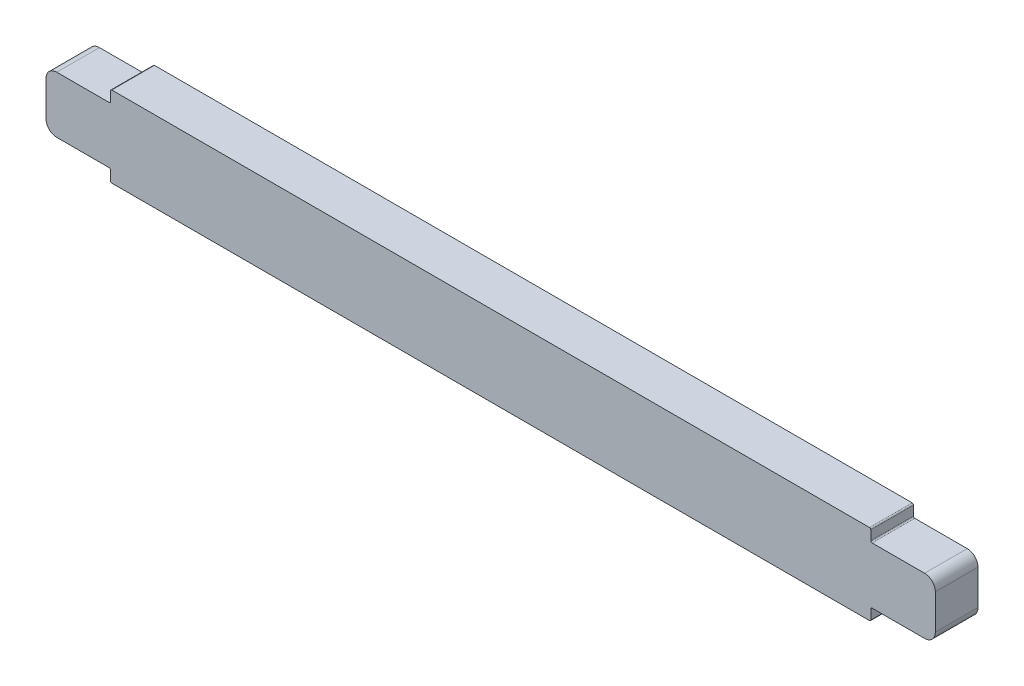
from build123d import *

# Parameters (mm, degrees)
SKETCH1_W           = 66.16
SKETCH1_H           = 6
BOSS_EXTRUDE1_DEPTH = 3.175
SKETCH3_W           = 4.8
SKETCH3_H           = 0.9
CUT_EXTRUDE1_DEPTH  = 34.367154883
FILLET1_R           = 0.8
FILLET2_R           = 0.1


with BuildPart() as part:
    # Sketch1 → Boss-Extrude1 (new body)
    with BuildSketch(Plane.XY):
        Rectangle(SKETCH1_W, SKETCH1_H)
    extrude(amount=BOSS_EXTRUDE1_DEPTH)

    # Sketch3 → Cut-Extrude1 (cut, through all)
    with BuildSketch(Plane.XY.offset(3.175)):
        with Locations((-30.68, 2.55)):
            Rectangle(SKETCH3_W, SKETCH3_H)
        with Locations((-30.68, -2.55)):
            Rectangle(SKETCH3_W, SKETCH3_H)
    cut_extrude1 = extrude(amount=-CUT_EXTRUDE1_DEPTH, mode=Mode.SUBTRACT)

    # Mirror1: Cut-Extrude1 across plane
    add(cut_extrude1.mirror(Plane(origin=(0, 0, 0), x_dir=(0, 0, 1), z_dir=(1, 0, 0))), mode=Mode.SUBTRACT)

    # Fillet1
    fillet1_edges = [part.edges().sort_by_distance(p)[0] for p in [
        (-33.08, 2.1, 1.5875),
        (-33.08, -2.1, 1.5875),
        (33.08, 2.1, 1.5875),
        (33.08, -2.1, 1.5875),
    ]]
    fillet(fillet1_edges, radius=FILLET1_R)

    # Fillet2
    fillet2_edges = [part.edges().sort_by_distance(p)[0] for p in [
        (-28.28, 3, 1.5875),
        (-28.28, 2.1, 1.5875),
        (-28.28, -2.1, 1.5875),
        (-28.28, -3, 1.5875),
        (28.28, 2.1, 1.5875),
        (28.28, 3, 1.5875),
        (28.28, -3, 1.5875),
        (28.28, -2.1, 1.5875),
    ]]
    fillet(fillet2_edges, radius=FILLET2_R)


solid = part.part
